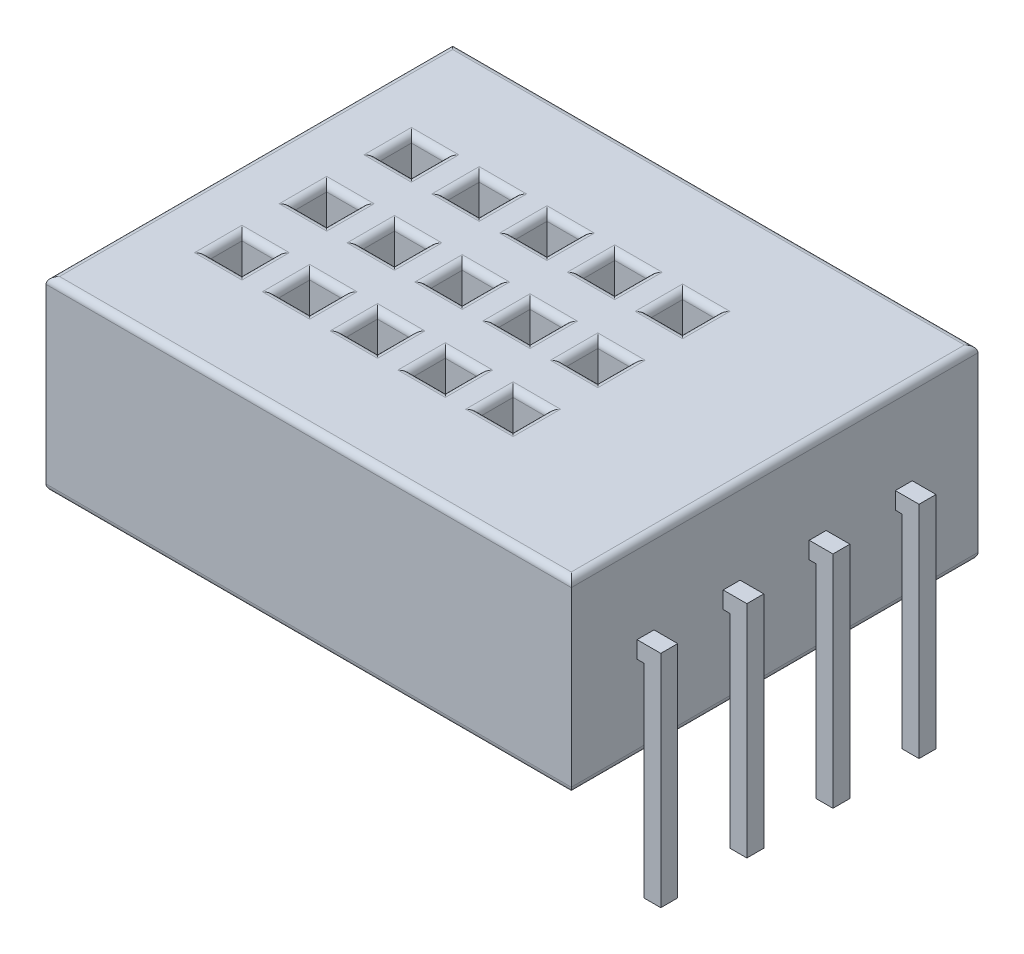
from build123d import *

# Parameters (mm, degrees)
SKETCH1_W           = 15.5
SKETCH1_H           = 12
BOSS_EXTRUDE1_DEPTH = 5.5
SKETCH2_W           = 0.5
SKETCH2_H           = 0.5
BOSS_EXTRUDE2_DEPTH = 0.7
SKETCH3_W           = 0.5
SKETCH3_H           = 0.5
BOSS_EXTRUDE3_DEPTH = 6
SKETCH4_W           = 1
SKETCH4_H           = 1
CUT_EXTRUDE1_DEPTH  = 3
LPATTERN1_COUNT     = 5
LPATTERN1_PITCH     = 2
FILLET1_R           = 0.2
FILLET2_R           = 0.2


with BuildPart() as part:
    # Sketch1 → Boss-Extrude1 (new body)
    with BuildSketch(Plane(origin=(0, 0, 0), x_dir=(1, 0, 0), z_dir=(0, 1, 0))):
        with Locations((7.75, -6)):
            Rectangle(SKETCH1_W, SKETCH1_H)
    extrude(amount=BOSS_EXTRUDE1_DEPTH)

    # Sketch2 → Boss-Extrude2 (add)
    with BuildSketch(Plane(origin=(15.5, 0, 0), x_dir=(0, 0, -1), z_dir=(1, 0, 0))):
        with Locations((-9.81, 2.75)):
            Rectangle(SKETCH2_W, SKETCH2_H)
        with Locations((-7.27, 2.75)):
            Rectangle(SKETCH2_W, SKETCH2_H)
        with Locations((-4.73, 2.75)):
            Rectangle(SKETCH2_W, SKETCH2_H)
        with Locations((-2.19, 2.75)):
            Rectangle(SKETCH2_W, SKETCH2_H)
    extrude(amount=BOSS_EXTRUDE2_DEPTH)

    # Sketch3 → Boss-Extrude3 (add)
    with BuildSketch(Plane.XZ.offset(-2.5)):
        with Locations((15.95, 9.81)):
            Rectangle(SKETCH3_W, SKETCH3_H)
        with Locations((15.95, 7.27)):
            Rectangle(SKETCH3_W, SKETCH3_H)
        with Locations((15.95, 4.73)):
            Rectangle(SKETCH3_W, SKETCH3_H)
        with Locations((15.95, 2.19)):
            Rectangle(SKETCH3_W, SKETCH3_H)
    extrude(amount=BOSS_EXTRUDE3_DEPTH)

    # Sketch4 → Cut-Extrude1 (cut)
    with BuildSketch(Plane(origin=(0, 5.5, 0), x_dir=(1, 0, 0), z_dir=(0, 1, 0))):
        with Locations((2.281693228, -3.5)):
            Rectangle(SKETCH4_W, SKETCH4_H)
        with Locations((2.281693228, -6)):
            Rectangle(SKETCH4_W, SKETCH4_H)
        with Locations((2.281693228, -8.5)):
            Rectangle(SKETCH4_W, SKETCH4_H)
    cut_extrude1 = extrude(amount=-CUT_EXTRUDE1_DEPTH, mode=Mode.SUBTRACT)

    # LPattern1: Cut-Extrude1 ×5
    with Locations(*[(i * LPATTERN1_PITCH, 0, 0) for i in range(1, LPATTERN1_COUNT)]):
        add(cut_extrude1, mode=Mode.SUBTRACT)

    # Fillet1
    fillet1_edges = [part.edges().sort_by_distance(p)[0] for p in [
        (2.781693228, 5.5, 3.5),
        (2.281693228, 5.5, 3),
        (1.781693228, 5.5, 3.5),
        (2.281693228, 5.5, 4),
        (15.5, 5.5, 6),
        (1.781693228, 5.5, 6),
        (2.281693228, 5.5, 6.5),
        (2.781693228, 5.5, 6),
        (2.281693228, 5.5, 5.5),
        (1.781693228, 5.5, 8.5),
        (2.281693228, 5.5, 9),
        (2.781693228, 5.5, 8.5),
        (2.281693228, 5.5, 8),
        (4.781693228, 5.5, 3.5),
        (4.281693228, 5.5, 3),
        (3.781693228, 5.5, 3.5),
        (4.281693228, 5.5, 4),
        (6.781693228, 5.5, 3.5),
        (7.75, 5.5, 0),
        (6.281693228, 5.5, 4),
        (5.781693228, 5.5, 3.5),
        (6.281693228, 5.5, 3),
        (8.781693228, 5.5, 3.5),
        (8.281693228, 5.5, 4),
        (7.781693228, 5.5, 3.5),
        (8.281693228, 5.5, 3),
        (10.781693228, 5.5, 3.5),
        (10.281693228, 5.5, 4),
        (9.781693228, 5.5, 3.5),
        (10.281693228, 5.5, 3),
        (3.781693228, 5.5, 8.5),
        (4.281693228, 5.5, 9),
        (4.781693228, 5.5, 8.5),
        (4.281693228, 5.5, 8),
        (5.781693228, 5.5, 8.5),
        (6.281693228, 5.5, 8),
        (6.781693228, 5.5, 8.5),
        (6.281693228, 5.5, 9),
        (7.781693228, 5.5, 8.5),
        (8.281693228, 5.5, 8),
        (8.781693228, 5.5, 8.5),
        (8.281693228, 5.5, 9),
        (9.781693228, 5.5, 8.5),
        (10.281693228, 5.5, 8),
        (10.781693228, 5.5, 8.5),
        (10.281693228, 5.5, 9),
        (3.781693228, 5.5, 6),
        (4.281693228, 5.5, 6.5),
        (4.781693228, 5.5, 6),
        (4.281693228, 5.5, 5.5),
        (5.781693228, 5.5, 6),
        (6.281693228, 5.5, 5.5),
        (6.781693228, 5.5, 6),
        (6.281693228, 5.5, 6.5),
        (7.781693228, 5.5, 6),
        (8.281693228, 5.5, 5.5),
        (8.781693228, 5.5, 6),
        (8.281693228, 5.5, 6.5),
        (9.781693228, 5.5, 6),
        (10.281693228, 5.5, 5.5),
        (10.781693228, 5.5, 6),
        (10.281693228, 5.5, 6.5),
        (0, 5.5, 6),
        (7.75, 5.5, 12),
    ]]
    fillet(fillet1_edges, radius=FILLET1_R)

    # Fillet2
    fillet2_edges = [part.edges().sort_by_distance(p)[0] for p in [
        (7.75, 0, 0),
        (15.5, 0, 6),
        (7.75, 0, 12),
        (0, 0, 6),
    ]]
    fillet(fillet2_edges, radius=FILLET2_R)


solid = part.part
